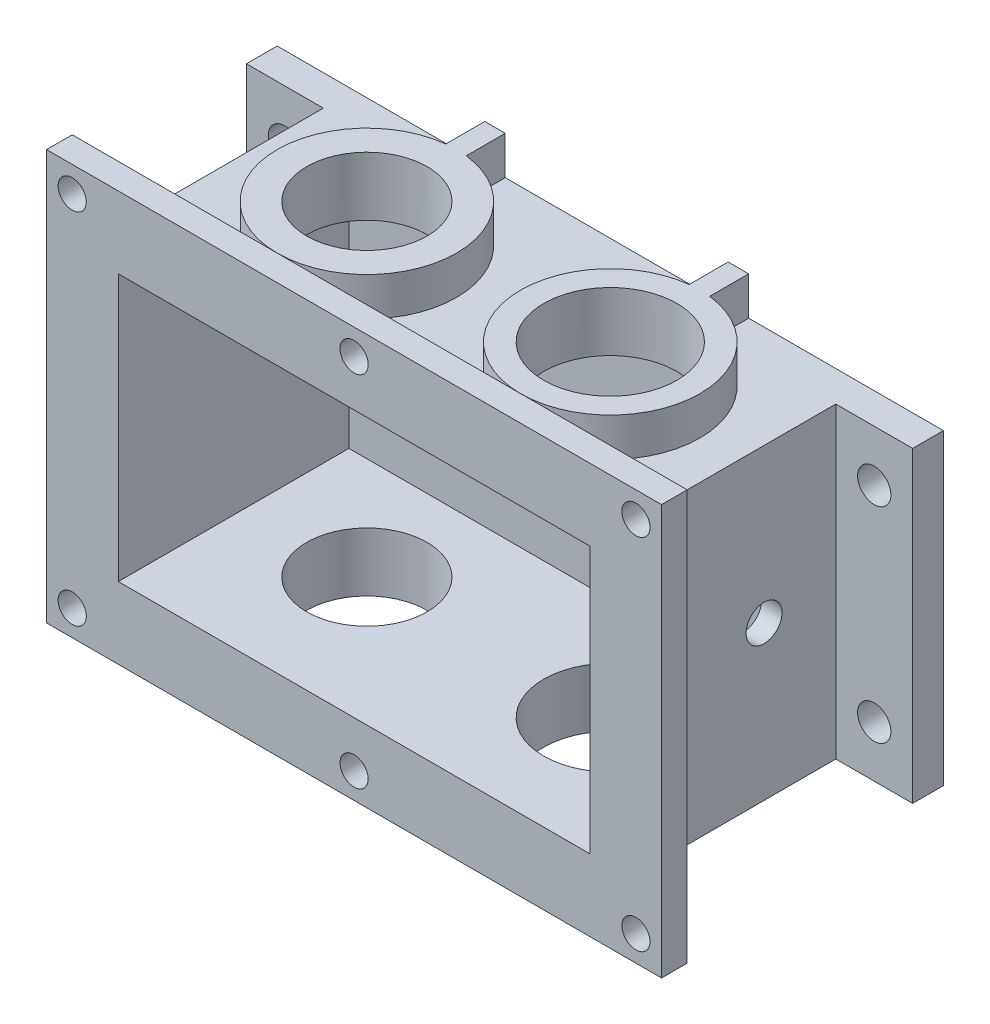
from build123d import *

# Parameters (mm, degrees)
SKETCH_1_W          = 200
SKETCH_1_H          = 120
EXTRUDE_1_DEPTH     = 100
SKETCH_2_W          = 184
SKETCH_2_H          = 104
CUT_EXTRUDE_1_DEPTH = 90
SKETCH_3_R          = 35
EXTRUDE_2_DEPTH     = 20
EXTRUDE_START       = -20
SKETCH_4_R          = 35
EXTRUDE_3_DEPTH     = 20
SKETCH_5_W          = 8
SKETCH_5_H          = 25
EXTRUDE_4_DEPTH     = 20
SKETCH_6_W          = 8
SKETCH_6_H          = 25
EXTRUDE_5_DEPTH     = 20
SKETCH_7_W          = 30
SKETCH_7_H          = 120
EXTRUDE_6_DEPTH     = 12
SKETCH_8_W          = 240
SKETCH_8_H          = 160
SKETCH_8_W_2        = 184
SKETCH_8_H_2        = 104
EXTRUDE_7_DEPTH     = 10
SKETCH_9_R          = 5.5
CUT_EXTRUDE_2_DEPTH = 10
SKETCH_10_R         = 23.5
CUT_EXTRUDE_3_DEPTH = 226.665681928
SKETCH_11_R         = 26
CUT_EXTRUDE_4_DEPTH = 226.665681928
SKETCH_12_R         = 5.1
CUT_EXTRUDE_5_DEPTH = 10
SKETCH_14_R         = 6.5
CUT_EXTRUDE_7_DEPTH = 12
SKETCH_15_R         = 7
CUT_EXTRUDE_8_DEPTH = 8


with BuildPart() as part:
    # 草图1 → 凸台-拉伸1 (new body)
    with BuildSketch(Plane.XY):
        Rectangle(SKETCH_1_W, SKETCH_1_H)
    extrude(amount=EXTRUDE_1_DEPTH)

    # 草图2 → 切除-拉伸1 (cut)
    with BuildSketch(Plane.XY.offset(10)):
        Rectangle(SKETCH_2_W, SKETCH_2_H)
    extrude(amount=CUT_EXTRUDE_1_DEPTH, mode=Mode.SUBTRACT)

    # 草图3 → 凸台-拉伸2 (add)
    with BuildSketch(Plane(origin=(0, 55, 0), x_dir=(1, 0, 0), z_dir=(0, 1, 0))):
        with Locations(Location((-45, -50, 0), (0, 0, 90))):
            Circle(SKETCH_3_R)
        with Locations(Location((50, -50, 0), (0, 0, 90))):
            Circle(SKETCH_3_R)
    extrude(amount=EXTRUDE_2_DEPTH)

    # 草图4 → 凸台-拉伸3 (add)
    with BuildSketch(Plane(origin=(0, -55, 0), x_dir=(1, 0, 0), z_dir=(0, 1, 0)).offset(EXTRUDE_START)):
        with Locations(Location((-45, -50, 0), (0, 0, 90))):
            Circle(SKETCH_4_R)
        with Locations(Location((50, -50, 0), (0, 0, 90))):
            Circle(SKETCH_4_R)
    extrude(amount=EXTRUDE_3_DEPTH)

    # 草图5 → 凸台-拉伸4 (add)
    with BuildSketch(Plane(origin=(0, 55, 0), x_dir=(1, 0, 0), z_dir=(0, 1, 0))):
        with Locations((-45, -12.5)):
            Rectangle(SKETCH_5_W, SKETCH_5_H)
        with Locations((50, -12.5)):
            Rectangle(SKETCH_5_W, SKETCH_5_H)
    extrude(amount=EXTRUDE_4_DEPTH)

    # 草图6 → 凸台-拉伸5 (add)
    with BuildSketch(Plane(origin=(0, -55, 0), x_dir=(1, 0, 0), z_dir=(0, 1, 0))):
        with Locations((-45, -12.5)):
            Rectangle(SKETCH_6_W, SKETCH_6_H)
        with Locations((50, -12.5)):
            Rectangle(SKETCH_6_W, SKETCH_6_H)
    extrude(amount=-EXTRUDE_5_DEPTH)

    # 草图7 → 凸台-拉伸6 (add)
    with BuildSketch(Plane.XY):
        with Locations((115, 0)):
            Rectangle(SKETCH_7_W, SKETCH_7_H)
        with Locations((-115, 0)):
            Rectangle(SKETCH_7_W, SKETCH_7_H)
    extrude(amount=EXTRUDE_6_DEPTH)

    # 草图8 → 凸台-拉伸7 (add)
    with BuildSketch(Plane.XY.offset(90)):
        Rectangle(SKETCH_8_W, SKETCH_8_H)
        Rectangle(SKETCH_8_W_2, SKETCH_8_H_2, mode=Mode.SUBTRACT)
    extrude(amount=EXTRUDE_7_DEPTH)

    # 草图9 → 切除-拉伸2 (cut)
    with BuildSketch(Plane.XY.offset(90)):
        with Locations((-110, 70)):
            Circle(SKETCH_9_R)
        with Locations((110, 70)):
            Circle(SKETCH_9_R)
        with Locations((-110, -70)):
            Circle(SKETCH_9_R)
        with Locations((110, -70)):
            Circle(SKETCH_9_R)
        with Locations((0, 70)):
            Circle(SKETCH_9_R)
        with Locations((0, -70)):
            Circle(SKETCH_9_R)
    extrude(amount=CUT_EXTRUDE_2_DEPTH, mode=Mode.SUBTRACT)

    # 草图10 → 切除-拉伸3 (cut, through all)
    with BuildSketch(Plane(origin=(0, 75, 0), x_dir=(1, 0, 0), z_dir=(0, 1, 0))):
        with Locations(Location((-45, -50, 0), (0, 0, 270))):
            Circle(SKETCH_10_R)
    extrude(amount=-CUT_EXTRUDE_3_DEPTH, mode=Mode.SUBTRACT)

    # 草图11 → 切除-拉伸4 (cut, through all)
    with BuildSketch(Plane(origin=(0, 75, 0), x_dir=(1, 0, 0), z_dir=(0, 1, 0))):
        with Locations(Location((50, -50, 0), (0, 0, 270))):
            Circle(SKETCH_11_R)
    extrude(amount=-CUT_EXTRUDE_4_DEPTH, mode=Mode.SUBTRACT)

    # 草图12 → 切除-拉伸5 (cut)
    with BuildSketch(Plane.XY):
        Circle(SKETCH_12_R)
    extrude(amount=CUT_EXTRUDE_5_DEPTH, mode=Mode.SUBTRACT)

    # 草图14 → 切除-拉伸7 (cut)
    with BuildSketch(Plane.XY):
        with Locations((115, 40)):
            Circle(SKETCH_14_R)
        with Locations((115, -40)):
            Circle(SKETCH_14_R)
        with Locations((-115, 40)):
            Circle(SKETCH_14_R)
        with Locations((-115, -40)):
            Circle(SKETCH_14_R)
    extrude(amount=CUT_EXTRUDE_7_DEPTH, mode=Mode.SUBTRACT)

    # 草图15 → 切除-拉伸8 (cut)
    with BuildSketch(Plane(origin=(100, 0, 0), x_dir=(0, 0, -1), z_dir=(1, 0, 0))):
        with Locations((-40, 0)):
            Circle(SKETCH_15_R)
    extrude(amount=-CUT_EXTRUDE_8_DEPTH, mode=Mode.SUBTRACT)


solid = part.part
